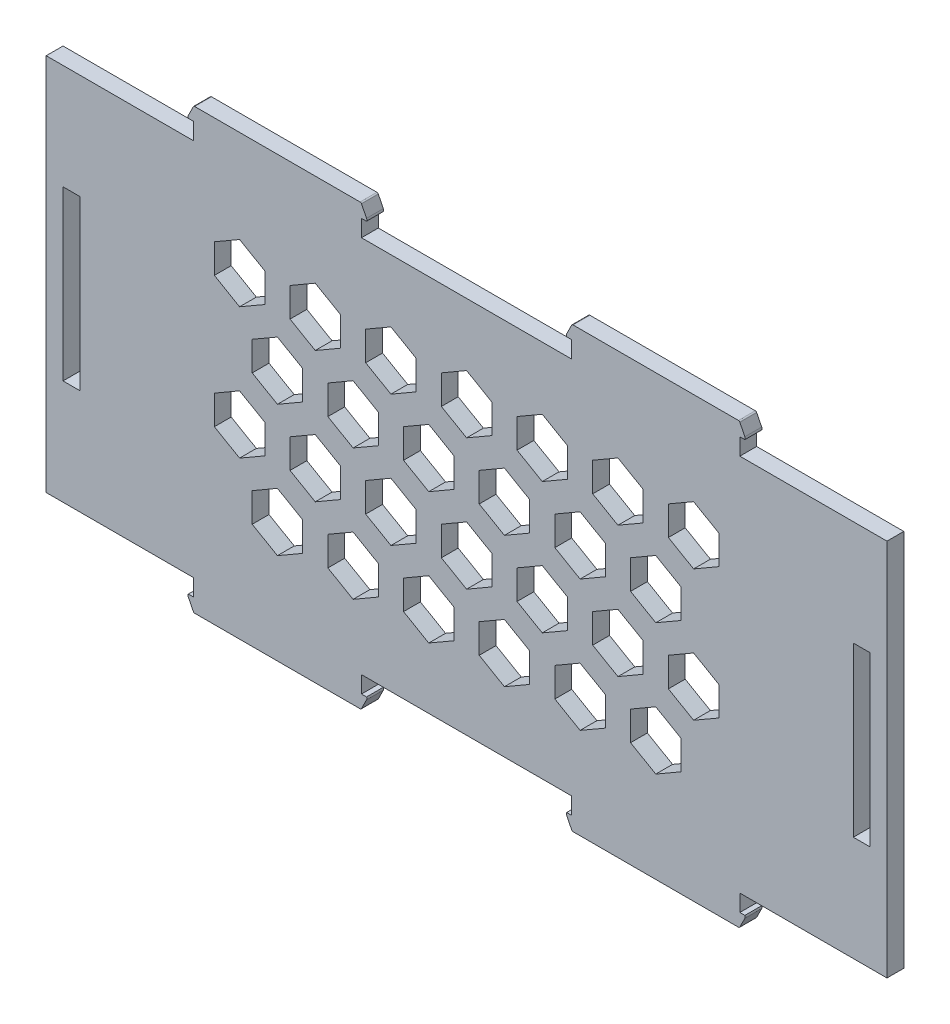
from build123d import *

# Parameters (mm, degrees)
SKETCH1_W           = 2
SKETCH1_H           = 20
BOSS_EXTRUDE1_DEPTH = 2
CUT_EXTRUDE1_DEPTH  = 112.202338105


with BuildPart() as part:
    # Sketch1 → Boss-Extrude1 (new body)
    with BuildSketch(Plane.XY):
        with BuildLine():
            Line((37.5, 0), (62.5, 0))
            Line((62.5, 0), (62.5, -2))
            Line((62.5, -2), (61.9, -2))
            ThreePointArc((61.9, -2), (61.864589803, -2.15), (61.9, -2.3))
            Line((61.9, -2.3), (62.5, -3.5))
            ThreePointArc((62.5, -3.5), (62.566697747, -3.572982477), (62.661803399, -3.6))
            Line((62.661803399, -3.6), (82.338196601, -3.6))
            ThreePointArc((82.338196601, -3.6), (82.433302253, -3.572982477), (82.5, -3.5))
            Line((82.5, -3.5), (83.1, -2.3))
            ThreePointArc((83.1, -2.3), (83.135410197, -2.15), (83.1, -2))
            Line((83.1, -2), (82.5, -2))
            Line((82.5, -2), (82.5, 0))
            Line((82.5, 0), (100, 0))
            Line((100, 0), (100, 45))
            Line((100, 45), (82.5, 45))
            Line((82.5, 45), (82.5, 47))
            Line((82.5, 47), (83.1, 47))
            ThreePointArc((83.1, 47), (83.135410197, 47.15), (83.1, 47.3))
            Line((83.1, 47.3), (82.5, 48.5))
            ThreePointArc((82.5, 48.5), (82.433302253, 48.572982477), (82.338196601, 48.6))
            Line((82.338196601, 48.6), (62.661803399, 48.6))
            ThreePointArc((62.661803399, 48.6), (62.566697747, 48.572982477), (62.5, 48.5))
            Line((62.5, 48.5), (61.9, 47.3))
            ThreePointArc((61.9, 47.3), (61.864589803, 47.15), (61.9, 47))
            Line((61.9, 47), (62.5, 47))
            Line((62.5, 47), (62.5, 45))
            Line((62.5, 45), (37.5, 45))
            Line((37.5, 45), (37.5, 47))
            Line((37.5, 47), (38.1, 47))
            ThreePointArc((38.1, 47), (38.135410197, 47.15), (38.1, 47.3))
            Line((38.1, 47.3), (37.5, 48.5))
            ThreePointArc((37.5, 48.5), (37.433302253, 48.572982477), (37.338196601, 48.6))
            Line((37.338196601, 48.6), (17.661803399, 48.6))
            ThreePointArc((17.661803399, 48.6), (17.566697747, 48.572982477), (17.5, 48.5))
            Line((17.5, 48.5), (16.9, 47.3))
            ThreePointArc((16.9, 47.3), (16.864589803, 47.15), (16.9, 47))
            Line((16.9, 47), (17.5, 47))
            Line((17.5, 47), (17.5, 45))
            Line((17.5, 45), (0, 45))
            Line((0, 45), (0, 0))
            Line((0, 0), (17.5, 0))
            Line((17.5, 0), (17.5, -2))
            Line((17.5, -2), (16.9, -2))
            ThreePointArc((16.9, -2), (16.864589803, -2.15), (16.9, -2.3))
            Line((16.9, -2.3), (17.5, -3.5))
            ThreePointArc((17.5, -3.5), (17.566697747, -3.572982477), (17.661803399, -3.6))
            Line((17.661803399, -3.6), (37.338196601, -3.6))
            ThreePointArc((37.338196601, -3.6), (37.433302253, -3.572982477), (37.5, -3.5))
            Line((37.5, -3.5), (38.1, -2.3))
            ThreePointArc((38.1, -2.3), (38.135410197, -2.15), (38.1, -2))
            Line((38.1, -2), (37.5, -2))
            Line((37.5, -2), (37.5, 0))
        make_face()
        with Locations((3, 22.5)):
            Rectangle(SKETCH1_W, SKETCH1_H, mode=Mode.SUBTRACT)
        with Locations((97, 22.5)):
            Rectangle(SKETCH1_W, SKETCH1_H, mode=Mode.SUBTRACT)
    extrude(amount=BOSS_EXTRUDE1_DEPTH)

    # Sketch2 → Cut-Extrude1 (cut, through all)
    with BuildSketch(Plane.XY.offset(2)):
        Polygon((20, 32.370729796), (23, 30.638678989), (26, 32.370729796), (26, 35.834831411), (23, 37.566882219), (20, 35.834831411), align=None)
        Polygon((30.5, 28.040602777), (27.5, 29.772653585), (24.5, 28.040602777), (24.5, 24.576501162), (27.5, 22.844450355), (30.5, 24.576501162), align=None)
        Polygon((29, 35.834831411), (29, 32.370729796), (32, 30.638678989), (35, 32.370729796), (35, 35.834831411), (32, 37.566882219), align=None)
        Polygon((39.5, 28.040602777), (36.5, 29.772653585), (33.5, 28.040602777), (33.5, 24.576501162), (36.5, 22.844450355), (39.5, 24.576501162), align=None)
        Polygon((44, 35.834831411), (41, 37.566882219), (38, 35.834831411), (38, 32.370729796), (41, 30.638678989), (44, 32.370729796), align=None)
        Polygon((48.5, 28.040602777), (45.5, 29.772653585), (42.5, 28.040602777), (42.5, 24.576501162), (45.5, 22.844450355), (48.5, 24.576501162), align=None)
        Polygon((53, 35.834831411), (50, 37.566882219), (47, 35.834831411), (47, 32.370729796), (50, 30.638678989), (53, 32.370729796), align=None)
        Polygon((56, 35.834831411), (56, 32.370729796), (59, 30.638678989), (62, 32.370729796), (62, 35.834831411), (59, 37.566882219), align=None)
        Polygon((66.5, 28.040602777), (63.5, 29.772653585), (60.5, 28.040602777), (60.5, 24.576501162), (63.5, 22.844450355), (66.5, 24.576501162), align=None)
        Polygon((71, 35.834831411), (68, 37.566882219), (65, 35.834831411), (65, 32.370729796), (68, 30.638678989), (71, 32.370729796), align=None)
        Polygon((75.5, 28.040602777), (72.5, 29.772653585), (69.5, 28.040602777), (69.5, 24.576501162), (72.5, 22.844450355), (75.5, 24.576501162), align=None)
        Polygon((80, 35.834831411), (77, 37.566882219), (74, 35.834831411), (74, 32.370729796), (77, 30.638678989), (80, 32.370729796), align=None)
        Polygon((51.5, 24.576501162), (54.5, 22.844450355), (57.5, 24.576501162), (57.5, 28.040602777), (54.5, 29.772653585), (51.5, 28.040602777), align=None)
        Polygon((20, 16.782272528), (23, 15.050221721), (26, 16.782272528), (26, 20.246374143), (23, 21.978424951), (20, 20.246374143), align=None)
        Polygon((30.5, 12.452145509), (27.5, 14.184196317), (24.5, 12.452145509), (24.5, 8.988043894), (27.5, 7.255993087), (30.5, 8.988043894), align=None)
        Polygon((29, 20.246374143), (29, 16.782272528), (32, 15.050221721), (35, 16.782272528), (35, 20.246374143), (32, 21.978424951), align=None)
        Polygon((39.5, 12.452145509), (36.5, 14.184196317), (33.5, 12.452145509), (33.5, 8.988043894), (36.5, 7.255993087), (39.5, 8.988043894), align=None)
        Polygon((44, 20.246374143), (41, 21.978424951), (38, 20.246374143), (38, 16.782272528), (41, 15.050221721), (44, 16.782272528), align=None)
        Polygon((48.5, 12.452145509), (45.5, 14.184196317), (42.5, 12.452145509), (42.5, 8.988043894), (45.5, 7.255993087), (48.5, 8.988043894), align=None)
        Polygon((53, 20.246374143), (50, 21.978424951), (47, 20.246374143), (47, 16.782272528), (50, 15.050221721), (53, 16.782272528), align=None)
        Polygon((56, 20.246374143), (56, 16.782272528), (59, 15.050221721), (62, 16.782272528), (62, 20.246374143), (59, 21.978424951), align=None)
        Polygon((66.5, 12.452145509), (63.5, 14.184196317), (60.5, 12.452145509), (60.5, 8.988043894), (63.5, 7.255993087), (66.5, 8.988043894), align=None)
        Polygon((71, 20.246374143), (68, 21.978424951), (65, 20.246374143), (65, 16.782272528), (68, 15.050221721), (71, 16.782272528), align=None)
        Polygon((75.5, 12.452145509), (72.5, 14.184196317), (69.5, 12.452145509), (69.5, 8.988043894), (72.5, 7.255993087), (75.5, 8.988043894), align=None)
        Polygon((80, 20.246374143), (77, 21.978424951), (74, 20.246374143), (74, 16.782272528), (77, 15.050221721), (80, 16.782272528), align=None)
        Polygon((51.5, 8.988043894), (54.5, 7.255993087), (57.5, 8.988043894), (57.5, 12.452145509), (54.5, 14.184196317), (51.5, 12.452145509), align=None)
    extrude(amount=-CUT_EXTRUDE1_DEPTH, mode=Mode.SUBTRACT)


solid = part.part
